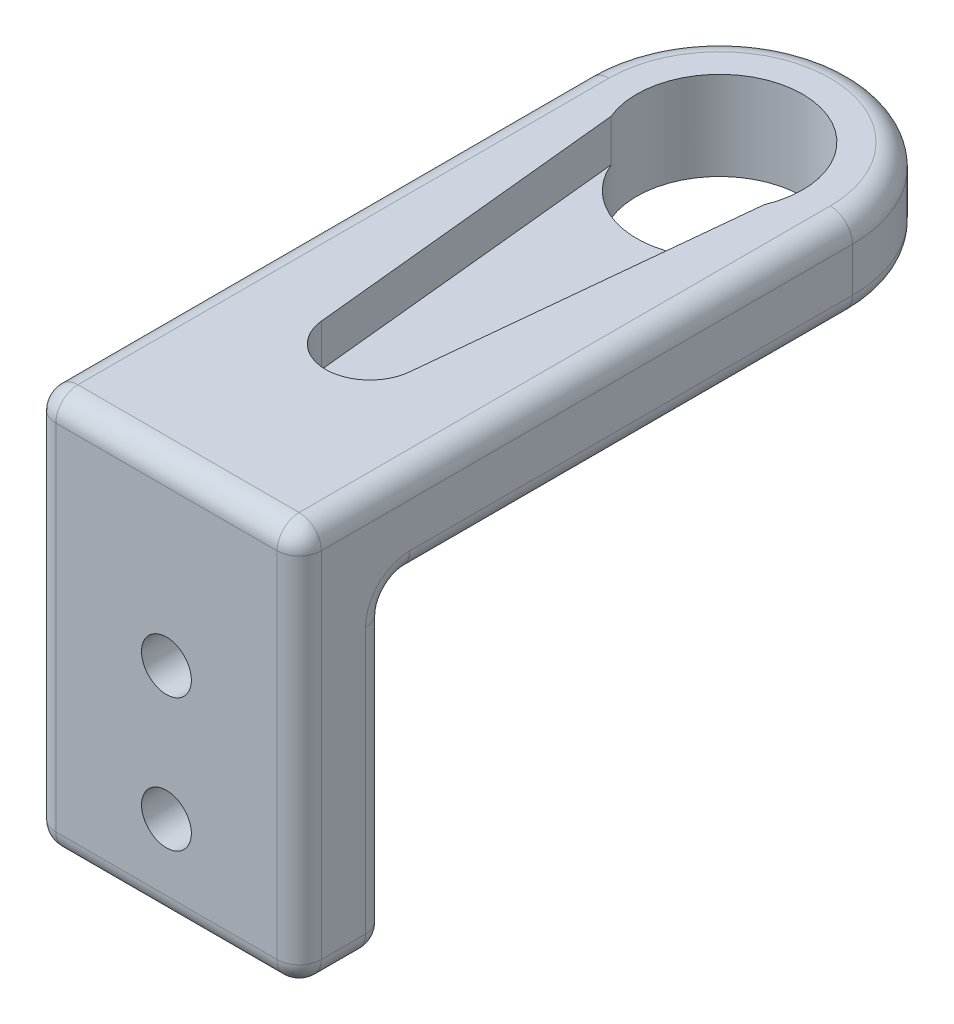
from build123d import *

# Parameters (mm, degrees)
YAW_ARM_BASE_DEPTH           = 4
YAW_ARM_MOUNTING_HOLE_REACH  = 28.019
SKETCH2_R                    = 3.75
YAW_ARM_SLOT_DEPTH           = 1.9
SKETCH5_W                    = 12
SKETCH5_H                    = 4
MOUNTING_BRACKET_DEPTH       = 14
BRACKET_MOUNTING_HOLES_REACH = 33
SKETCH8_R                    = 1.125
F_1MM_FILLETS_R              = 1


with BuildPart() as part:
    # Sketch1 → Yaw Arm Base (new body)
    with BuildSketch(Plane(origin=(0, 0, 0), x_dir=(1, 0, 0), z_dir=(0, 1, 0))):
        with BuildLine():
            Line((-6, 0), (-6, -25))
            Line((-6, -25), (6, -25))
            Line((6, -25), (6, 0))
            ThreePointArc((6, 0), (0, 6), (-6, 0))
        make_face()
    extrude(amount=YAW_ARM_BASE_DEPTH)

    # Sketch2 → Yaw Arm Mounting Hole (cut, up to next)
    with BuildSketch(Plane(origin=(0, 4, 0), x_dir=(1, 0, 0), z_dir=(0, 1, 0)), mode=Mode.PRIVATE) as yaw_arm_mounting_hole_sk1:
        with Locations(Location((0, 0, 0), (0, 0, 270))):
            Circle(SKETCH2_R)
    yaw_arm_mounting_hole_tool1 = extrude(yaw_arm_mounting_hole_sk1.sketch, amount=-YAW_ARM_MOUNTING_HOLE_REACH, mode=Mode.PRIVATE) & part.part
    add(yaw_arm_mounting_hole_tool1.solids().sort_by_distance((0, 4, 0))[0], mode=Mode.SUBTRACT)

    # Sketch4 → Yaw Arm Slot (cut)
    with BuildSketch(Plane(origin=(0, 4, 0), x_dir=(1, 0, 0), z_dir=(0, 1, 0))):
        with BuildLine():
            Line((-3.46, -1.445994467), (-1.989882432, -16.005994467))
            ThreePointArc((-1.989882432, -16.005994467), (0, -17.805076808), (1.989882432, -16.005994467))
            Line((1.989882432, -16.005994467), (3.46, -1.445994467))
            ThreePointArc((3.46, -1.445994467), (0, -3.75), (-3.46, -1.445994467))
        make_face()
    extrude(amount=-YAW_ARM_SLOT_DEPTH, mode=Mode.SUBTRACT)

    # Sketch5 → Mounting Bracket (add)
    with BuildSketch(Plane.XZ):
        with Locations((0, 23)):
            Rectangle(SKETCH5_W, SKETCH5_H)
    extrude(amount=MOUNTING_BRACKET_DEPTH)

    # Sketch8 → Bracket Mounting Holes (cut, up to next)
    with BuildSketch(Plane(origin=(0, 0, 21), x_dir=(-1, 0, 0), z_dir=(0, 0, -1)), mode=Mode.PRIVATE) as bracket_mounting_holes_sk1:
        with Locations((0, -10)):
            Circle(SKETCH8_R)
    bracket_mounting_holes_tool1 = extrude(bracket_mounting_holes_sk1.sketch, amount=-BRACKET_MOUNTING_HOLES_REACH, mode=Mode.PRIVATE) & part.part
    # Sketch8 → Bracket Mounting Holes (cut, up to next)
    with BuildSketch(Plane(origin=(0, 0, 21), x_dir=(-1, 0, 0), z_dir=(0, 0, -1)), mode=Mode.PRIVATE) as bracket_mounting_holes_sk2:
        with Locations((0, -4)):
            Circle(SKETCH8_R)
    bracket_mounting_holes_tool2 = extrude(bracket_mounting_holes_sk2.sketch, amount=-BRACKET_MOUNTING_HOLES_REACH, mode=Mode.PRIVATE) & part.part
    add(bracket_mounting_holes_tool1.solids().sort_by_distance((0, -10, 21))[0], mode=Mode.SUBTRACT)
    add(bracket_mounting_holes_tool2.solids().sort_by_distance((0, -4, 21))[0], mode=Mode.SUBTRACT)

    # 1mm Fillets
    f_1mm_fillets_edges = [part.edges().sort_by_distance(p)[0] for p in [
        (0, 4, 25),
        (6, 4, 12.5),
        (6, 0, 10.5),
        (0, 0, 21),
        (-6, -7, 21),
        (6, -7, 21),
        (-6, -14, 23),
        (0, -14, 21),
        (6, -14, 23),
        (0, -14, 25),
        (0, 4, -6),
        (-6, 0, 10.5),
        (0, 0, -6),
        (6, -5, 25),
        (-6, -5, 25),
        (-6, 4, 12.5),
    ]]
    fillet(f_1mm_fillets_edges, radius=F_1MM_FILLETS_R)


solid = part.part
